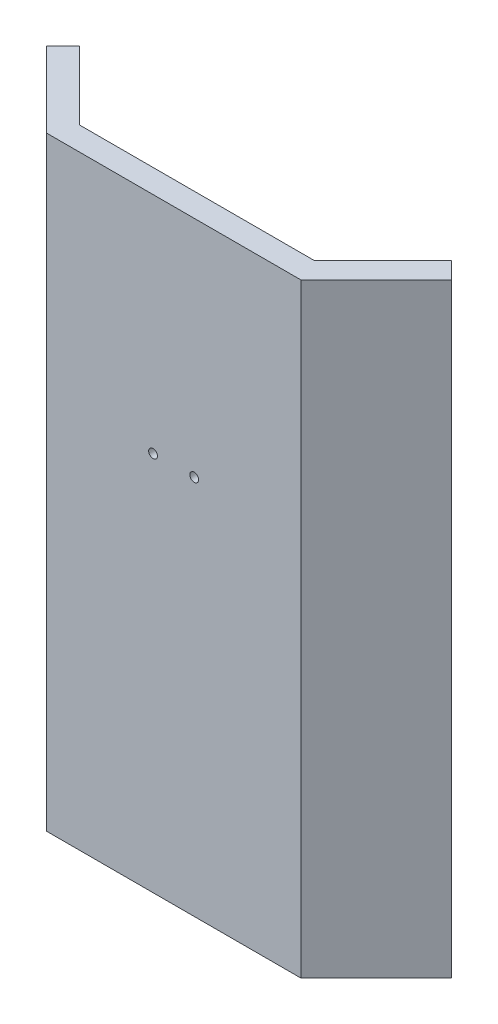
from build123d import *

# Parameters (mm, degrees)
SALIENTE_EXTRUIR1_DEPTH = 206
CROQUIS2_W              = 10
CROQUIS2_H              = 6
SALIENTE_EXTRUIR2_DEPTH = 10
CORTAR_EXTRUIR1_DEPTH   = 10
CROQUIS4_R              = 1.5
CORTAR_EXTRUIR4_DEPTH   = 10


with BuildPart() as part:
    # Croquis1 → Saliente-Extruir1 (new body)
    with BuildSketch(Plane(origin=(0, 0, 0), x_dir=(1, 0, 0), z_dir=(0, 1, 0))):
        Polygon((-40, 0), (40, 0), (63.334523779, 23.334523779), (68.991378029, 17.67766953), (43.313708499, -8), (-43.313708499, -8), (-68.991378029, 17.67766953), (-63.334523779, 23.334523779), align=None)
    extrude(amount=SALIENTE_EXTRUIR1_DEPTH)

    # Croquis2 → Saliente-Extruir2 (add)
    with BuildSketch(Plane(origin=(0, 0, 0), x_dir=(-1, 0, 0), z_dir=(0, 0, -1))):
        with Locations((29, 9.404106992)):
            Rectangle(CROQUIS2_W, CROQUIS2_H)
        with Locations((-29, 9.404106992)):
            Rectangle(CROQUIS2_W, CROQUIS2_H)
    extrude(amount=SALIENTE_EXTRUIR2_DEPTH)

    # Croquis3 → Cortar-Extruir1 (cut)
    with BuildSketch(Plane.XZ.offset(-6.404106992)):
        with BuildLine():
            ThreePointArc((-27.5, -5), (-28.425974851, -3.614180701), (-30.060660172, -3.939339828))
            Line((-30.060660172, -3.939339828), (-27.939339828, -6.060660172))
            ThreePointArc((-27.939339828, -6.060660172), (-27.614180701, -5.574025149), (-27.5, -5))
        make_face()
        with BuildLine():
            Line((-27.939339828, -6.060660172), (-30.060660172, -3.939339828))
            ThreePointArc((-30.060660172, -3.939339828), (-30.060660172, -6.060660172), (-27.939339828, -6.060660172))
        make_face()
        with BuildLine():
            ThreePointArc((29, -3.5), (27.5, -5), (29, -6.5))
            Line((29, -6.5), (29, -3.5))
        make_face()
        with BuildLine():
            Line((29, -3.5), (29, -6.5))
            ThreePointArc((29, -6.5), (30.060660172, -6.060660172), (30.5, -5))
            ThreePointArc((30.5, -5), (30.060660172, -3.939339828), (29, -3.5))
        make_face()
    extrude(amount=-CORTAR_EXTRUIR1_DEPTH, mode=Mode.SUBTRACT)

    # Croquis4 → Cortar-Extruir4 (cut)
    with BuildSketch(Plane.XY.offset(8)):
        with Locations((-7.000068571, 129.596)):
            Circle(CROQUIS4_R)
        with Locations((6.999931429, 129.596)):
            Circle(CROQUIS4_R)
    extrude(amount=-CORTAR_EXTRUIR4_DEPTH, mode=Mode.SUBTRACT)


solid = part.part
